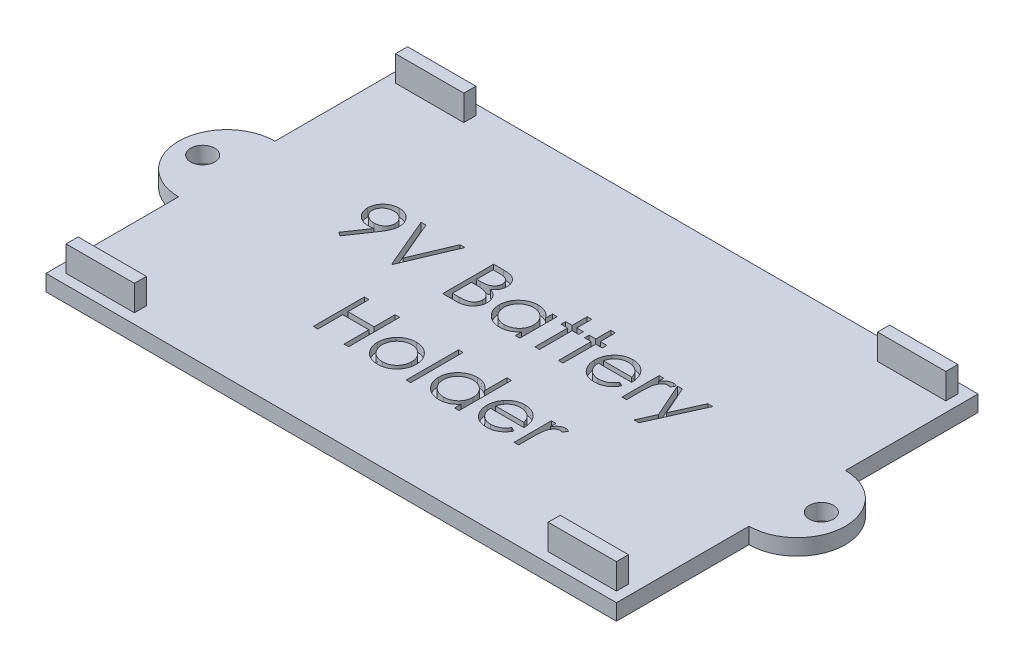
from build123d import *

# Parameters (mm, degrees)
SKETCH1_W               = 71
SKETCH1_H               = 45
BOSS_EXTRUDE1_DEPTH     = 2
SKETCH2_W               = 8.5
SKETCH2_H               = 1.5
BOSS_EXTRUDE2_DEPTH     = 3.175
MIRROR2_COPY_1_SKETCH_W = 8.5
MIRROR2_COPY_1_SKETCH_H = 1.5
MIRROR2_COPY_1_DEPTH    = 3.175
SKETCH3_W               = 0.569871795
SKETCH3_H               = 6.512820512
CUT_EXTRUDE1_DEPTH      = 1
BOSS_EXTRUDE3_DEPTH     = 2
SKETCH5_R               = 1.5
CUT_EXTRUDE2_DEPTH      = 2


with BuildPart() as part:
    # Sketch1 → Boss-Extrude1 (new body)
    with BuildSketch(Plane(origin=(0, 0, 0), x_dir=(1, 0, 0), z_dir=(0, 1, 0))):
        Rectangle(SKETCH1_W, SKETCH1_H)
    extrude(amount=BOSS_EXTRUDE1_DEPTH)

    # Sketch2 → Boss-Extrude2 (add)
    with BuildSketch(Plane(origin=(0, 2, 0), x_dir=(1, 0, 0), z_dir=(0, 1, 0))):
        with Locations((-30, -20.5)):
            Rectangle(SKETCH2_W, SKETCH2_H)
    boss_extrude2 = extrude(amount=BOSS_EXTRUDE2_DEPTH)

    # Mirror1: Boss-Extrude2 across plane
    add(boss_extrude2.mirror(Plane.XY))

    # Mirror2: Boss-Extrude2 across plane
    add(boss_extrude2.mirror(Plane(origin=(0, 0, 0), x_dir=(0, 0, 1), z_dir=(1, 0, 0))))

    # Mirror2 copy 1 sketch → Mirror2 copy 1 (add)
    with BuildSketch(Plane(origin=(0, 2, 0), x_dir=(-1, 0, 0), z_dir=(0, 1, 0))):
        with Locations((-30, -20.5)):
            Rectangle(MIRROR2_COPY_1_SKETCH_W, MIRROR2_COPY_1_SKETCH_H)
    extrude(amount=MIRROR2_COPY_1_DEPTH)

    # Sketch3 → Cut-Extrude1 (cut)
    # profile 1 of 15: a face of its own
    with BuildSketch(Plane(origin=(0, 2, 0), x_dir=(1, 0, 0), z_dir=(0, 1, 0))):
        with BuildLine():
            Line((-21.248076923, -0.162820513), (-21.703465545, 0.153916266))
            Line((-21.703465545, 0.153916266), (-19.937880609, 2.734875801))
            add(Edge.make_bspline(
                [(-19.937880609, 2.734875801), (-20.050530944, 2.721099815), (-20.272345733, 2.69397413), (-20.495751618, 2.688990913), (-20.605699119, 2.686538462)],
                knots=[0, 0, 0, 0, 1.015715272, 2, 2, 2, 2], degree=3))
            add(Edge.make_bspline(
                [(-20.605699119, 2.686538462), (-20.672359691, 2.688245843), (-20.803208565, 2.691597284), (-20.995580278, 2.718161707), (-21.180429795, 2.759074082), (-21.357267055, 2.820122538), (-21.526756728, 2.895992717), (-21.688528808, 2.990076156), (-21.842365524, 3.100758999), (-21.986614682, 3.227455998), (-22.117808837, 3.366571893), (-22.234691105, 3.513811417), (-22.331830016, 3.670884964), (-22.41252325, 3.834588362), (-22.47371993, 4.007274527), (-22.518283391, 4.186978439), (-22.545719662, 4.374959561), (-22.548983736, 4.502912298), (-22.550641026, 4.567878606)],
                knots=[0, 0, 0, 0, 1.060718605, 2.082097864, 3.085795603, 4.069760067, 5.054557537, 6.03741023, 7.043284206, 8.066802108, 9.088538119, 10.083643548, 11.053783639, 12.022749082, 12.983451788, 13.964007469, 14.966251758, 16, 16, 16, 16], degree=3))
            add(Edge.make_bspline(
                [(-22.550641026, 4.567878606), (-22.547494265, 4.656721733), (-22.541317813, 4.831102769), (-22.491609075, 5.08588975), (-22.409856745, 5.326802479), (-22.295868119, 5.553207545), (-22.152295124, 5.761848115), (-21.979740968, 5.949823734), (-21.779255204, 6.114460826), (-21.555404969, 6.255982509), (-21.313464489, 6.369801719), (-21.060065638, 6.453693021), (-20.79715002, 6.503039321), (-20.619045818, 6.509545097), (-20.529377003, 6.512820513)],
                knots=[0, 0, 0, 0, 1.022988612, 2.007919123, 2.978103895, 3.94594894, 4.918897164, 5.887013414, 6.875921846, 7.89917871, 8.930658928, 9.948724884, 10.967259574, 12, 12, 12, 12], degree=3))
            add(Edge.make_bspline(
                [(-20.529377003, 6.512820513), (-20.441405156, 6.509500074), (-20.267581078, 6.5029392), (-20.011968167, 6.454889713), (-19.767146607, 6.373906036), (-19.53447356, 6.261992613), (-19.319046341, 6.121710395), (-19.125324512, 5.954552044), (-18.957728891, 5.760413445), (-18.816534136, 5.543990042), (-18.703195634, 5.311458519), (-18.621421635, 5.068736259), (-18.571083118, 4.817568865), (-18.564739782, 4.64739889), (-18.561538462, 4.561518429)],
                knots=[0, 0, 0, 0, 1.026385292, 2.028040595, 3.023318987, 4.028184125, 5.03290303, 6.015178782, 7.004435299, 8.016004309, 9.023023918, 10.015172535, 10.998308025, 12, 12, 12, 12], degree=3))
            add(Edge.make_bspline(
                [(-18.561538462, 4.561518429), (-18.563676432, 4.494854738), (-18.56801277, 4.359644114), (-18.598377213, 4.15421192), (-18.649939549, 3.944750404), (-18.708453345, 3.767455509), (-18.764935993, 3.621027322), (-18.818096617, 3.505363741), (-18.877082953, 3.383622877), (-18.945878427, 3.257081278), (-19.01983288, 3.124125822), (-19.103397567, 2.986090038), (-19.194666248, 2.842788693), (-19.259671596, 2.746183262), (-19.292958734, 2.696714744)],
                knots=[0, 0, 0, 0, 1.179839688, 2.393009684, 3.667231171, 4.993948276, 5.694988576, 6.444077775, 7.246288328, 8.089075292, 8.993003841, 9.939041771, 10.944649915, 12, 12, 12, 12], degree=3))
            Line((-19.292958734, 2.696714744), (-21.248076923, -0.162820513))
        make_face()
        with BuildLine():
            add(Edge.make_bspline(
                [(-20.500120192, 3.337820513), (-20.449621338, 3.339200066), (-20.351317237, 3.341885588), (-20.207304137, 3.358230927), (-20.071370225, 3.387212301), (-19.943152387, 3.428795208), (-19.821365008, 3.478972307), (-19.707942527, 3.54285691), (-19.602790019, 3.619087091), (-19.505203351, 3.704739548), (-19.418545809, 3.799899892), (-19.341360596, 3.899498928), (-19.275754995, 4.003973864), (-19.223933049, 4.114633068), (-19.18132532, 4.228782861), (-19.151901212, 4.348261477), (-19.135601065, 4.472446432), (-19.13282235, 4.556808283), (-19.131410256, 4.599679487)],
                knots=[0, 0, 0, 0, 1.163407946, 2.26475976, 3.333800367, 4.359385343, 5.366239384, 6.363380779, 7.350133999, 8.353570782, 9.349036268, 10.310270964, 11.253520213, 12.184142, 13.120487599, 14.056272588, 15.012232024, 16, 16, 16, 16], degree=3))
            add(Edge.make_bspline(
                [(-19.131410256, 4.599679487), (-19.132625228, 4.642568594), (-19.135019477, 4.72708684), (-19.154227864, 4.851455654), (-19.18801934, 4.970641998), (-19.23335922, 5.085298378), (-19.293085937, 5.194482767), (-19.364756547, 5.299565963), (-19.44990542, 5.399881681), (-19.547881504, 5.493070623), (-19.653535622, 5.57897324), (-19.766131101, 5.65478512), (-19.884739877, 5.718323577), (-20.008638337, 5.770754565), (-20.138084627, 5.811669929), (-20.273002149, 5.841092862), (-20.41407267, 5.857370189), (-20.509833004, 5.86013134), (-20.558633814, 5.861538462)],
                knots=[0, 0, 0, 0, 0.972161553, 1.915763587, 2.844109794, 3.775983486, 4.705125789, 5.659731448, 6.655561913, 7.682237399, 8.721216875, 9.739758359, 10.754845918, 11.767244016, 12.7857855, 13.828538656, 14.893392813, 16, 16, 16, 16], degree=3))
            add(Edge.make_bspline(
                [(-20.558633814, 5.861538462), (-20.607010207, 5.860129067), (-20.70192429, 5.857363846), (-20.841740694, 5.841123803), (-20.975745956, 5.811472053), (-21.104817181, 5.770773517), (-21.22871196, 5.718319666), (-21.347315142, 5.654781791), (-21.459936958, 5.578990691), (-21.56548978, 5.493003032), (-21.663638867, 5.400315446), (-21.747323755, 5.29912651), (-21.819158388, 5.19453743), (-21.878803036, 5.085283851), (-21.924164746, 4.970645876), (-21.957950377, 4.851454604), (-21.977160334, 4.727087114), (-21.979554369, 4.642568686), (-21.980769231, 4.599679487)],
                knots=[0, 0, 0, 0, 1.099389452, 2.15699305, 3.192601482, 4.213358962, 5.227959689, 6.245255729, 7.266013209, 8.307253147, 9.336162325, 10.327954924, 11.284637477, 12.215801273, 13.149702402, 14.080068371, 15.025723358, 16, 16, 16, 16], degree=3))
            add(Edge.make_bspline(
                [(-21.980769231, 4.599679487), (-21.979669908, 4.556774898), (-21.977501841, 4.472159196), (-21.956587137, 4.34783274), (-21.921610829, 4.228655588), (-21.874767078, 4.113468934), (-21.813078479, 4.003392848), (-21.737379497, 3.898949206), (-21.648650864, 3.798954032), (-21.548078679, 3.704960948), (-21.438009301, 3.618687715), (-21.320449491, 3.543339736), (-21.197423072, 3.479708301), (-21.068496971, 3.42865179), (-20.934626634, 3.387627772), (-20.794608895, 3.35828434), (-20.648906807, 3.342042371), (-20.550191555, 3.3392413), (-20.500120192, 3.337820513)],
                knots=[0, 0, 0, 0, 0.952633368, 1.87876736, 2.791047057, 3.707742249, 4.635551637, 5.587206343, 6.568248508, 7.601284464, 8.641511608, 9.671105535, 10.699146789, 11.713763218, 12.747829548, 13.806491675, 14.887386225, 16, 16, 16, 16], degree=3))
        make_face(mode=Mode.SUBTRACT)
    # profile 2 of 15: a face of its own
    with BuildSketch(Plane(origin=(0, 2, 0), x_dir=(1, 0, 0), z_dir=(0, 1, 0))):
        Polygon((-17.666025641, 6.35), (-17.055448718, 6.35), (-14.938782051, 1.345813301), (-12.822115385, 6.35), (-12.211538462, 6.35), (-14.898076923, 0), (-14.979487179, 0), align=None)
    # profile 3 of 15: a face of its own
    with BuildSketch(Plane(origin=(0, 2, 0), x_dir=(1, 0, 0), z_dir=(0, 1, 0))):
        with BuildLine():
            Line((-8.629487179, 6.35), (-7.39052484, 6.35))
            add(Edge.make_bspline(
                [(-7.39052484, 6.35), (-7.329876029, 6.349681139), (-7.212323541, 6.349063106), (-7.041382553, 6.339477996), (-6.881273997, 6.326408481), (-6.731951438, 6.305671027), (-6.593483878, 6.280648803), (-6.465454022, 6.250346937), (-6.348268995, 6.214012938), (-6.208364459, 6.156234684), (-6.04885126, 6.070376936), (-5.876134176, 5.943506539), (-5.728443628, 5.788326213), (-5.601105595, 5.61327911), (-5.499866421, 5.420718496), (-5.426624982, 5.215233967), (-5.380255693, 4.99947595), (-5.375486963, 4.851351899), (-5.373076923, 4.776492388)],
                knots=[0, 0, 0, 0, 1.001505555, 1.941167018, 2.826882275, 3.653841531, 4.429895133, 5.150066043, 5.825578002, 6.45369114, 7.647487171, 8.808567382, 9.977351308, 11.170798116, 12.373658725, 13.556498008, 14.765093433, 16, 16, 16, 16], degree=3))
            add(Edge.make_bspline(
                [(-5.373076923, 4.776492388), (-5.375060334, 4.706365608), (-5.378957923, 4.568559873), (-5.416228357, 4.367003418), (-5.474576999, 4.175140492), (-5.555685094, 3.993671307), (-5.661098715, 3.826696038), (-5.786027379, 3.672867712), (-5.936752435, 3.538699366), (-6.049679456, 3.463691528), (-6.107041266, 3.425590946)],
                knots=[0, 0, 0, 0, 1.044552857, 2.05264487, 3.044412934, 4.028983338, 5.005914585, 5.980388656, 6.974128949, 8, 8, 8, 8], degree=3))
            add(Edge.make_bspline(
                [(-6.107041266, 3.425590946), (-6.03490449, 3.397895876), (-5.896888969, 3.344908347), (-5.706958632, 3.251226863), (-5.543319413, 3.149332748), (-5.404713162, 3.038059249), (-5.286171988, 2.918118978), (-5.182661652, 2.78775327), (-5.09433973, 2.645261524), (-5.018660569, 2.492129396), (-4.959607826, 2.329920517), (-4.91538297, 2.160156395), (-4.890042027, 1.983445773), (-4.886435878, 1.863185156), (-4.884615385, 1.802473958)],
                knots=[0, 0, 0, 0, 1.27268992, 2.434971085, 3.483601985, 4.442670788, 5.356604649, 6.2567628, 7.179492994, 8.113709626, 9.066344395, 10.018646069, 10.999752585, 12, 12, 12, 12], degree=3))
            add(Edge.make_bspline(
                [(-4.884615385, 1.802473958), (-4.886387662, 1.74048549), (-4.889874669, 1.618521443), (-4.915601189, 1.439351413), (-4.959160569, 1.268128296), (-5.019161077, 1.103744607), (-5.097469848, 0.946518363), (-5.192770583, 0.796271441), (-5.306402134, 0.654513441), (-5.433516197, 0.519669154), (-5.577320375, 0.398424454), (-5.732470387, 0.290445958), (-5.900920139, 0.201643816), (-6.079903043, 0.127047606), (-6.271426873, 0.070065974), (-6.474631604, 0.030201447), (-6.68934198, 0.00334088), (-6.836679671, 0.001132523), (-6.912239583, 0)],
                knots=[0, 0, 0, 0, 0.978564426, 1.925352924, 2.850884081, 3.763762016, 4.682927383, 5.618979971, 6.567305752, 7.547517671, 8.540179244, 9.531824382, 10.526200242, 11.540722885, 12.589160233, 13.674978461, 14.80764778, 16, 16, 16, 16], degree=3))
            Line((-6.912239583, 0), (-8.629487179, 0))
            Line((-8.629487179, 0), (-8.629487179, 6.35))
        make_face()
        with BuildLine():
            Line((-8.059615385, 5.698717949), (-8.059615385, 3.663461538))
            Line((-8.059615385, 3.663461538), (-7.676732772, 3.663461538))
            add(Edge.make_bspline(
                [(-7.676732772, 3.663461538), (-7.620764244, 3.664187113), (-7.51262164, 3.665589071), (-7.356012685, 3.669605023), (-7.210643009, 3.680850045), (-7.076763541, 3.692091835), (-6.954585107, 3.710370015), (-6.844378387, 3.732127153), (-6.744413789, 3.755137566), (-6.6291349, 3.794270778), (-6.498373979, 3.852105989), (-6.358976776, 3.941862034), (-6.236087095, 4.048767646), (-6.132315054, 4.172122677), (-6.047385672, 4.307951329), (-5.988396503, 4.454086383), (-5.948396431, 4.606885765), (-5.944783224, 4.711784596), (-5.942948718, 4.765044071)],
                knots=[0, 0, 0, 0, 1.156816544, 2.235205308, 3.236616184, 4.169592532, 5.011045266, 5.787822928, 6.49130361, 7.128639758, 8.301311294, 9.436451833, 10.541879658, 11.654887649, 12.756523258, 13.837046038, 14.901820046, 16, 16, 16, 16], degree=3))
            add(Edge.make_bspline(
                [(-5.942948718, 4.765044071), (-5.943903359, 4.80028797), (-5.945775992, 4.869422728), (-5.961112698, 4.970205128), (-5.987179583, 5.064990222), (-6.020660944, 5.155076965), (-6.067448993, 5.237648464), (-6.122536991, 5.315559691), (-6.189095315, 5.386157392), (-6.264855011, 5.452142053), (-6.351956369, 5.510642839), (-6.450347427, 5.561879652), (-6.561359356, 5.603137918), (-6.68312125, 5.639271509), (-6.817507366, 5.664650271), (-6.962966913, 5.685792846), (-7.120691331, 5.696556535), (-7.229811732, 5.697981407), (-7.286217949, 5.698717949)],
                knots=[0, 0, 0, 0, 0.91205012, 1.789085906, 2.630437955, 3.453916878, 4.269457761, 5.079663411, 5.91843418, 6.774407191, 7.675494373, 8.627863946, 9.638891023, 10.736472738, 11.911756761, 13.175263542, 14.539845004, 16, 16, 16, 16], degree=3))
            Line((-7.286217949, 5.698717949), (-8.059615385, 5.698717949))
        make_face(mode=Mode.SUBTRACT)
        with BuildLine():
            Line((-8.059615385, 3.012179487), (-8.059615385, 0.651282051))
            Line((-8.059615385, 0.651282051), (-7.248056891, 0.651282051))
            add(Edge.make_bspline(
                [(-7.248056891, 0.651282051), (-7.189965411, 0.651978279), (-7.078001742, 0.653320165), (-6.916346653, 0.657700857), (-6.766517308, 0.667665414), (-6.629197404, 0.683351456), (-6.502904154, 0.700366642), (-6.389152608, 0.723247109), (-6.287020671, 0.749461652), (-6.168594427, 0.789982221), (-6.035238062, 0.852931533), (-5.891526937, 0.947844487), (-5.763753655, 1.060916774), (-5.655249828, 1.191782861), (-5.566326263, 1.334079697), (-5.50163708, 1.484929117), (-5.461739383, 1.641838574), (-5.456909447, 1.748821038), (-5.454487179, 1.802473958)],
                knots=[0, 0, 0, 0, 1.160039823, 2.235823828, 3.228722157, 4.157150951, 4.99529583, 5.772374946, 6.472645482, 7.099169577, 8.269452708, 9.405989375, 10.527446681, 11.663510218, 12.788923519, 13.866172445, 14.929861265, 16, 16, 16, 16], degree=3))
            add(Edge.make_bspline(
                [(-5.454487179, 1.802473958), (-5.454988112, 1.836026162), (-5.455981896, 1.902589369), (-5.470969012, 2.000408069), (-5.492765604, 2.095160725), (-5.520944062, 2.187104626), (-5.561982238, 2.274577466), (-5.609891256, 2.359309252), (-5.666064085, 2.441411994), (-5.753592786, 2.545211368), (-5.880904815, 2.664803663), (-6.061801393, 2.781893131), (-6.267491133, 2.876322724), (-6.416675299, 2.916417488), (-6.493739984, 2.937129407)],
                knots=[0, 0, 0, 0, 0.723448775, 1.435228256, 2.130040452, 2.821711965, 3.505591119, 4.210454504, 4.921174351, 5.648778258, 7.137944449, 8.670945889, 10.280296675, 12, 12, 12, 12], degree=3))
            add(Edge.make_bspline(
                [(-6.493739984, 2.937129407), (-6.524635629, 2.943397917), (-6.591623761, 2.956989338), (-6.700857514, 2.971336171), (-6.825564019, 2.984117923), (-6.966031239, 2.993572452), (-7.122436894, 3.003345181), (-7.295115018, 3.007145785), (-7.483360432, 3.011680157), (-7.613975164, 3.012008786), (-7.681820913, 3.012179487)],
                knots=[0, 0, 0, 0, 0.634451884, 1.375622551, 2.216452059, 3.157844607, 4.20941857, 5.370758133, 6.634282058, 8, 8, 8, 8], degree=3))
            Line((-7.681820913, 3.012179487), (-8.059615385, 3.012179487))
        make_face(mode=Mode.SUBTRACT)
    # profile 4 of 15: a face of its own
    with BuildSketch(Plane(origin=(0, 2, 0), x_dir=(1, 0, 0), z_dir=(0, 1, 0))):
        with BuildLine():
            Line((0.976923077, 4.640384615), (0.976923077, 0))
            Line((0.976923077, 0), (0.407051282, 0))
            Line((0.407051282, 0), (0.407051282, 0.802654247))
            add(Edge.make_bspline(
                [(0.407051282, 0.802654247), (0.342791476, 0.730010983), (0.217387657, 0.588246742), (0.007944486, 0.403040514), (-0.214066351, 0.249954131), (-0.44756732, 0.126310713), (-0.692347561, 0.033433696), (-0.947864462, -0.032581193), (-1.214222253, -0.075024294), (-1.396108668, -0.079262505), (-1.48828125, -0.081410256)],
                knots=[0, 0, 0, 0, 1.074387032, 2.096679803, 3.090159297, 4.057316773, 5.018401886, 5.985159533, 6.978961417, 8, 8, 8, 8], degree=3))
            add(Edge.make_bspline(
                [(-1.48828125, -0.081410256), (-1.570228823, -0.079185267), (-1.731833067, -0.074797489), (-1.969557249, -0.040757309), (-2.198324616, 0.013908247), (-2.418351341, 0.089928433), (-2.628213662, 0.190767923), (-2.829708409, 0.311492759), (-3.021791721, 0.455258265), (-3.201535799, 0.619610831), (-3.367056714, 0.79812745), (-3.512310737, 0.988528657), (-3.633419897, 1.189991122), (-3.734693472, 1.39996413), (-3.812701125, 1.620064056), (-3.867081861, 1.849529775), (-3.901082386, 2.088089974), (-3.905468351, 2.250540251), (-3.907692308, 2.33291266)],
                knots=[0, 0, 0, 0, 1.033919861, 2.038935746, 3.024066025, 3.998881131, 4.97069526, 5.957263378, 6.95902576, 7.993208707, 9.027059324, 10.027763471, 11.009749337, 11.988697705, 12.965288445, 13.950418724, 14.960734635, 16, 16, 16, 16], degree=3))
            add(Edge.make_bspline(
                [(-3.907692308, 2.33291266), (-3.90541906, 2.413582522), (-3.900924971, 2.573062488), (-3.867445558, 2.807610983), (-3.811146442, 3.033522685), (-3.732138204, 3.250070282), (-3.630824943, 3.457515801), (-3.507583985, 3.656005961), (-3.36240643, 3.846087582), (-3.195034206, 4.023291094), (-3.01372398, 4.186977065), (-2.819760997, 4.329233476), (-2.617970187, 4.452091188), (-2.405221582, 4.549433923), (-2.18466412, 4.628190441), (-1.954334297, 4.682678826), (-1.715190433, 4.714786824), (-1.552829112, 4.71943641), (-1.470472756, 4.721794872)],
                knots=[0, 0, 0, 0, 1.020392517, 2.01726096, 2.990465484, 3.961182959, 4.928053699, 5.906110375, 6.912531644, 7.948652711, 8.985773172, 9.998621852, 10.987621588, 11.969261332, 12.953316658, 13.946091881, 14.958173133, 16, 16, 16, 16], degree=3))
            add(Edge.make_bspline(
                [(-1.470472756, 4.721794872), (-1.375767298, 4.71918638), (-1.190054363, 4.71407125), (-0.918404975, 4.671503159), (-0.661421422, 4.599587654), (-0.417119955, 4.501765908), (-0.186377853, 4.371774642), (0.028620418, 4.20779957), (0.230124938, 4.010874845), (0.346929182, 3.859617039), (0.407051282, 3.781760817)],
                knots=[0, 0, 0, 0, 1.038897134, 2.037228247, 3.008116434, 3.962042015, 4.918381754, 5.904844433, 6.921570401, 8, 8, 8, 8], degree=3))
            Line((0.407051282, 3.781760817), (0.407051282, 4.640384615))
            Line((0.407051282, 4.640384615), (0.976923077, 4.640384615))
        make_face()
        with BuildLine():
            add(Edge.make_bspline(
                [(-1.462840545, 4.151923077), (-1.546142272, 4.148959191), (-1.710566632, 4.143108953), (-1.951946464, 4.09743704), (-2.182929373, 4.021446419), (-2.402360108, 3.917520684), (-2.606772443, 3.786839976), (-2.789459532, 3.628776895), (-2.951915576, 3.447644026), (-3.088546284, 3.244258769), (-3.199926185, 3.026221375), (-3.278243515, 2.798302752), (-3.329894864, 2.564613721), (-3.335171751, 2.406112848), (-3.337820513, 2.326552484)],
                knots=[0, 0, 0, 0, 1.031046209, 2.035121221, 3.029706178, 4.034933723, 5.034054252, 6.02443088, 7.017295772, 8.038157696, 9.050218397, 10.03989886, 11.016116709, 12, 12, 12, 12], degree=3))
            add(Edge.make_bspline(
                [(-3.337820513, 2.326552484), (-3.334437064, 2.247467575), (-3.327683427, 2.089607744), (-3.279150024, 1.855600126), (-3.197725111, 1.627627793), (-3.086614511, 1.407625704), (-2.947483064, 1.203365979), (-2.786213651, 1.018780328), (-2.601246712, 0.860049218), (-2.396363949, 0.727175335), (-2.177546632, 0.619837618), (-1.947433642, 0.545151387), (-1.710350698, 0.496931699), (-1.549147178, 0.491299291), (-1.467928686, 0.488461538)],
                knots=[0, 0, 0, 0, 0.979072187, 1.954306742, 2.945804271, 3.96968567, 4.997920485, 5.998718438, 6.996577872, 8.005894225, 9.015743152, 10.005417472, 10.995077863, 12, 12, 12, 12], degree=3))
            add(Edge.make_bspline(
                [(-1.467928686, 0.488461538), (-1.385475745, 0.491473187), (-1.221485024, 0.497463058), (-0.979389082, 0.543330497), (-0.744448221, 0.619111031), (-0.519862821, 0.724156589), (-0.310646412, 0.854344935), (-0.122871691, 1.0067578), (0.03590728, 1.184019291), (0.170513872, 1.378830856), (0.276060699, 1.59239405), (0.352942978, 1.819786081), (0.398397921, 2.061014867), (0.404126945, 2.225867992), (0.407051282, 2.310016026)],
                knots=[0, 0, 0, 0, 1.01762866, 2.023962475, 3.030623092, 4.058876274, 5.077231937, 6.066672613, 7.034107872, 8.005628644, 8.981990164, 9.965428785, 10.961468474, 12, 12, 12, 12], degree=3))
            add(Edge.make_bspline(
                [(0.407051282, 2.310016026), (0.405310191, 2.374128947), (0.401883173, 2.500323464), (0.375701997, 2.685611961), (0.334055202, 2.862928863), (0.275370008, 3.032460599), (0.198278678, 3.193269842), (0.105300588, 3.346511235), (-0.005199299, 3.491387776), (-0.131442191, 3.62590449), (-0.26962763, 3.748598215), (-0.415849153, 3.858116194), (-0.571839166, 3.948084396), (-0.734974361, 4.022544989), (-0.905537782, 4.081798018), (-1.084917335, 4.121327119), (-1.271206354, 4.148469416), (-1.398289912, 4.150759736), (-1.462840545, 4.151923077)],
                knots=[0, 0, 0, 0, 1.050140795, 2.067009409, 3.05949893, 4.030605086, 5.00011959, 5.97591094, 6.962425594, 7.979863591, 8.993523472, 9.986985069, 10.967611495, 11.937549037, 12.921786183, 13.919465291, 14.943216303, 16, 16, 16, 16], degree=3))
        make_face(mode=Mode.SUBTRACT)
    # profile 5 of 15: a face of its own
    with BuildSketch(Plane(origin=(0, 2, 0), x_dir=(1, 0, 0), z_dir=(0, 1, 0))):
        Polygon((2.849358974, 6.512820513), (3.419230769, 6.512820513), (3.419230769, 4.640384615), (4.233333333, 4.640384615), (4.233333333, 4.070512821), (3.419230769, 4.070512821), (3.419230769, 0), (2.849358974, 0), (2.849358974, 4.070512821), (2.03525641, 4.070512821), (2.03525641, 4.640384615), (2.849358974, 4.640384615), align=None)
    # profile 6 of 15: a face of its own
    with BuildSketch(Plane(origin=(0, 2, 0), x_dir=(1, 0, 0), z_dir=(0, 1, 0))):
        Polygon((5.780128205, 6.512820513), (6.35, 6.512820513), (6.35, 4.640384615), (7.164102564, 4.640384615), (7.164102564, 4.070512821), (6.35, 4.070512821), (6.35, 0), (5.780128205, 0), (5.780128205, 4.070512821), (4.966025641, 4.070512821), (4.966025641, 4.640384615), (5.780128205, 4.640384615), align=None)
    # profile 7 of 15: a face of its own
    with BuildSketch(Plane(origin=(0, 2, 0), x_dir=(1, 0, 0), z_dir=(0, 1, 0))):
        with BuildLine():
            Line((11.949499199, 1.465384615), (12.455769231, 1.199529247))
            add(Edge.make_bspline(
                [(12.455769231, 1.199529247), (12.415425694, 1.127967774), (12.336933147, 0.988737488), (12.201948933, 0.79745397), (12.06044903, 0.625373114), (11.906046116, 0.477092169), (11.743359699, 0.3478218), (11.571487597, 0.234723175), (11.389535027, 0.138351002), (11.197493384, 0.05715713), (10.993749912, -0.005271524), (10.777810875, -0.049366324), (10.549262591, -0.076622826), (10.39260595, -0.07978901), (10.312389824, -0.081410256)],
                knots=[0, 0, 0, 0, 1.120438281, 2.179929193, 3.190490725, 4.156257408, 5.095198341, 6.022838206, 6.959905092, 7.901321166, 8.864066838, 9.862729781, 10.905609505, 12, 12, 12, 12], degree=3))
            add(Edge.make_bspline(
                [(10.312389824, -0.081410256), (10.223232236, -0.079328953), (10.049311611, -0.075268932), (9.796146641, -0.040266889), (9.557786839, 0.016832962), (9.334245606, 0.096599015), (9.126070377, 0.200788589), (8.932847397, 0.327715078), (8.753560543, 0.476726454), (8.593859478, 0.64911343), (8.450088433, 0.833593552), (8.323223017, 1.0258278), (8.217164535, 1.225332507), (8.130890514, 1.430837601), (8.061213116, 1.641047808), (8.012650668, 1.857875756), (7.984656696, 2.080734602), (7.980366917, 2.231496911), (7.978205128, 2.307471955)],
                knots=[0, 0, 0, 0, 1.145258523, 2.234067595, 3.276747158, 4.290159414, 5.277019952, 6.260822364, 7.254936242, 8.264827045, 9.274100331, 10.257902744, 11.220704747, 12.172965371, 13.118907548, 14.062713208, 15.023725156, 16, 16, 16, 16], degree=3))
            add(Edge.make_bspline(
                [(7.978205128, 2.307471955), (7.980126713, 2.378764005), (7.983935041, 2.520055432), (8.007939469, 2.729180063), (8.050481373, 2.932431684), (8.108858417, 3.129979182), (8.18424425, 3.321491797), (8.276468419, 3.507086084), (8.38567459, 3.686564552), (8.469989298, 3.799781666), (8.512459936, 3.856810897)],
                knots=[0, 0, 0, 0, 1.024358464, 2.0301432, 3.019427413, 4.004406732, 4.986367066, 5.972626655, 6.978780325, 8, 8, 8, 8], degree=3))
            add(Edge.make_bspline(
                [(8.512459936, 3.856810897), (8.569986732, 3.925515847), (8.683218021, 4.060749349), (8.874727408, 4.238437454), (9.082100622, 4.387288304), (9.302738857, 4.510672679), (9.53920646, 4.604423439), (9.788324746, 4.674287195), (10.052930309, 4.713435872), (10.233824067, 4.718965513), (10.326382212, 4.721794872)],
                knots=[0, 0, 0, 0, 1.030682036, 2.02871468, 2.997146059, 3.962720338, 4.930598197, 5.918074684, 6.934738563, 8, 8, 8, 8], degree=3))
            add(Edge.make_bspline(
                [(10.326382212, 4.721794872), (10.421537153, 4.71933824), (10.608209456, 4.714518889), (10.88041059, 4.669839684), (11.13796789, 4.598987192), (11.380778291, 4.498922458), (11.608866409, 4.3698187), (11.820749671, 4.209904216), (12.020051701, 4.024088544), (12.136000122, 3.881189578), (12.195002003, 3.808473558)],
                knots=[0, 0, 0, 0, 1.056321875, 2.072262726, 3.055038591, 4.01806755, 4.982017516, 5.957941055, 6.960871419, 8, 8, 8, 8], degree=3))
            add(Edge.make_bspline(
                [(12.195002003, 3.808473558), (12.235146591, 3.753675631), (12.315168553, 3.64444453), (12.415402577, 3.466334003), (12.502410994, 3.279987638), (12.571957938, 3.082393242), (12.628272461, 2.875892004), (12.669015547, 2.659007673), (12.692908997, 2.431804834), (12.697605634, 2.276998083), (12.7, 2.198076923)],
                knots=[0, 0, 0, 0, 0.94817472, 1.890038105, 2.849395472, 3.817997239, 4.812318967, 5.836947057, 6.897266129, 8, 8, 8, 8], degree=3))
            Line((12.7, 2.198076923), (8.548076923, 2.198076923))
            add(Edge.make_bspline(
                [(8.548076923, 2.198076923), (8.550870209, 2.136934652), (8.556363093, 2.016700843), (8.581971996, 1.840768136), (8.622337628, 1.673176501), (8.679068642, 1.515182982), (8.747769918, 1.364724036), (8.831926862, 1.222915769), (8.932328624, 1.090404096), (9.044316678, 0.966003718), (9.16897098, 0.855222051), (9.300112536, 0.756068114), (9.439619432, 0.672963675), (9.586391669, 0.605508732), (9.740191908, 0.552701558), (9.901068605, 0.516655655), (10.068705187, 0.492512761), (10.182979305, 0.489828226), (10.241155849, 0.488461538)],
                knots=[0, 0, 0, 0, 1.094153842, 2.151609401, 3.174256925, 4.172055639, 5.149267565, 6.128595816, 7.11444997, 8.118368179, 9.117203808, 10.09244225, 11.054858984, 12.015122123, 12.976791628, 13.957293641, 14.960065497, 16, 16, 16, 16], degree=3))
            add(Edge.make_bspline(
                [(10.241155849, 0.488461538), (10.298035789, 0.489564727), (10.410896499, 0.491753665), (10.578973483, 0.513038703), (10.744326626, 0.547456203), (10.906271553, 0.594428042), (11.061521516, 0.651717474), (11.205295585, 0.720846944), (11.337521119, 0.797318628), (11.461104759, 0.884784752), (11.580976418, 0.991842463), (11.699889215, 1.1254387), (11.827391143, 1.283440357), (11.907200833, 1.402358923), (11.949499199, 1.465384615)],
                knots=[0, 0, 0, 0, 0.99110716, 1.966546729, 2.947904876, 3.932708344, 4.903319531, 5.828989031, 6.710028674, 7.56322171, 8.463672341, 9.504779593, 10.677557249, 12, 12, 12, 12], degree=3))
        make_face()
        with BuildLine():
            add(Edge.make_bspline(
                [(12.130128205, 2.767948718), (12.109270043, 2.843537075), (12.069124796, 2.989020329), (11.985238821, 3.19048023), (11.890766169, 3.369528279), (11.778966742, 3.524794185), (11.652295625, 3.662686273), (11.505982222, 3.783188563), (11.341905673, 3.890988796), (11.160914089, 3.981979759), (10.969249707, 4.05943136), (10.768578473, 4.111365498), (10.563822201, 4.146942811), (10.425329996, 4.150255893), (10.355639022, 4.151923077)],
                knots=[0, 0, 0, 0, 1.154881502, 2.222775134, 3.210006277, 4.132804581, 5.035138423, 5.962687519, 6.919655026, 7.923214229, 8.944639381, 9.960483929, 10.97369054, 12, 12, 12, 12], degree=3))
            add(Edge.make_bspline(
                [(10.355639022, 4.151923077), (10.298762184, 4.15081333), (10.186328632, 4.148619594), (10.020682408, 4.127809502), (9.861606383, 4.093410926), (9.70792679, 4.046303076), (9.5616575, 3.983513183), (9.419789849, 3.909883615), (9.28593113, 3.820001027), (9.202217637, 3.751495676), (9.159925881, 3.716887019)],
                knots=[0, 0, 0, 0, 1.04873581, 2.073130211, 3.073294108, 4.04793562, 5.032784715, 6.005352987, 6.992311501, 8, 8, 8, 8], degree=3))
            add(Edge.make_bspline(
                [(9.159925881, 3.716887019), (9.129639498, 3.689501618), (9.068347241, 3.63408024), (8.986449437, 3.538595823), (8.908035151, 3.435632274), (8.836672667, 3.321250405), (8.771217617, 3.196752706), (8.709967373, 3.063189282), (8.65483774, 2.919546603), (8.623820511, 2.819448035), (8.60786258, 2.767948718)],
                knots=[0, 0, 0, 0, 0.879870761, 1.780643979, 2.707998968, 3.669668524, 4.684282772, 5.740141944, 6.837334558, 8, 8, 8, 8], degree=3))
            Line((8.60786258, 2.767948718), (12.130128205, 2.767948718))
        make_face(mode=Mode.SUBTRACT)
    # profile 8 of 15: a face of its own
    with BuildSketch(Plane(origin=(0, 2, 0), x_dir=(1, 0, 0), z_dir=(0, 1, 0))):
        with BuildLine():
            Line((13.676923077, 4.640384615), (14.246794872, 4.640384615))
            Line((14.246794872, 4.640384615), (14.246794872, 3.957301683))
            add(Edge.make_bspline(
                [(14.246794872, 3.957301683), (14.288865906, 4.020902971), (14.369326431, 4.142539941), (14.503062745, 4.303411387), (14.640047361, 4.436607258), (14.780936058, 4.542749356), (14.926764896, 4.622238872), (15.074333366, 4.680464807), (15.225963147, 4.714895079), (15.327856923, 4.71949186), (15.37890625, 4.721794872)],
                knots=[0, 0, 0, 0, 1.2804753, 2.448899062, 3.506932113, 4.484331642, 5.4025378, 6.288909075, 7.142734305, 8, 8, 8, 8], degree=3))
            add(Edge.make_bspline(
                [(15.37890625, 4.721794872), (15.418505442, 4.719634916), (15.499983354, 4.715190668), (15.623323196, 4.683965315), (15.75040203, 4.634112331), (15.832303218, 4.587230784), (15.875, 4.562790465)],
                knots=[0, 0, 0, 0, 0.901110191, 1.854092781, 2.881294221, 4, 4, 4, 4], degree=3))
            Line((15.875, 4.562790465), (15.562079327, 4.069240785))
            add(Edge.make_bspline(
                [(15.562079327, 4.069240785), (15.534667246, 4.081469554), (15.482633868, 4.104682097), (15.406516298, 4.13215403), (15.336337301, 4.148330049), (15.291626845, 4.150780636), (15.270783253, 4.151923077)],
                knots=[0, 0, 0, 0, 1.180555205, 2.24091978, 3.179933427, 4, 4, 4, 4], degree=3))
            add(Edge.make_bspline(
                [(15.270783253, 4.151923077), (15.225052851, 4.148875009), (15.131776086, 4.142657834), (14.994825637, 4.09378314), (14.861934279, 4.014815919), (14.756394263, 3.92723833), (14.674674747, 3.842787326), (14.616363195, 3.76903951), (14.562873068, 3.68634685), (14.51176424, 3.596122995), (14.465198249, 3.496827417), (14.421737635, 3.389452159), (14.382442269, 3.273872854), (14.360035398, 3.193350281), (14.348557692, 3.152103365)],
                knots=[0, 0, 0, 0, 1.125678352, 2.296057538, 3.5422874, 4.923748041, 5.663163013, 6.437101912, 7.23742474, 8.08941207, 8.991984279, 9.93940061, 10.944477711, 12, 12, 12, 12], degree=3))
            add(Edge.make_bspline(
                [(14.348557692, 3.152103365), (14.339971779, 3.115314779), (14.320954632, 3.033830856), (14.302464271, 2.897127104), (14.284195288, 2.735612751), (14.271319995, 2.548838219), (14.259385547, 2.337269928), (14.252654398, 2.100585569), (14.247024414, 1.838542203), (14.246873707, 1.655345877), (14.246794872, 1.559515224)],
                knots=[0, 0, 0, 0, 0.566838948, 1.255505196, 2.06880316, 3.007127437, 4.065329342, 5.249902469, 6.561414163, 8, 8, 8, 8], degree=3))
            Line((14.246794872, 1.559515224), (14.246794872, 0))
            Line((14.246794872, 0), (13.676923077, 0))
            Line((13.676923077, 0), (13.676923077, 4.640384615))
        make_face()
    # profile 9 of 15: a face of its own
    with BuildSketch(Plane(origin=(0, 2, 0), x_dir=(1, 0, 0), z_dir=(0, 1, 0))):
        Polygon((15.956410256, 4.640384615), (16.570803285, 4.640384615), (18.141766827, 1.086318109), (19.736899038, 4.640384615), (20.352564103, 4.640384615), (17.503205128, -1.709615385), (16.887540064, -1.709615385), (17.83266226, 0.395602965), align=None)
    # profile 10 of 15: a face of its own
    with BuildSketch(Plane(origin=(0, 2, 0), x_dir=(1, 0, 0), z_dir=(0, 1, 0))):
        Polygon((-13.14775641, -5.233333333), (-12.577884615, -5.233333333), (-12.577884615, -7.838461538), (-9.321474359, -7.838461538), (-9.321474359, -5.233333333), (-8.751602564, -5.233333333), (-8.751602564, -11.583333333), (-9.321474359, -11.583333333), (-9.321474359, -8.48974359), (-12.577884615, -8.48974359), (-12.577884615, -11.583333333), (-13.14775641, -11.583333333), align=None)
    # profile 11 of 15: a face of its own
    with BuildSketch(Plane(origin=(0, 2, 0), x_dir=(1, 0, 0), z_dir=(0, 1, 0))):
        with BuildLine():
            add(Edge.make_bspline(
                [(-5.044891827, -6.861538462), (-4.957821946, -6.863392464), (-4.787099189, -6.86702771), (-4.53707631, -6.905880576), (-4.298415849, -6.965293651), (-4.070203758, -7.0474292), (-3.855362765, -7.157523596), (-3.650763507, -7.288894738), (-3.456966934, -7.444528872), (-3.340810867, -7.564921368), (-3.281850962, -7.626031651)],
                knots=[0, 0, 0, 0, 1.054011418, 2.066658804, 3.057071809, 4.030435133, 4.997543892, 5.974964718, 6.972108034, 8, 8, 8, 8], degree=3))
            add(Edge.make_bspline(
                [(-3.281850962, -7.626031651), (-3.231083702, -7.684477025), (-3.130531669, -7.800236694), (-3.001598151, -7.987934735), (-2.890524749, -8.182317489), (-2.80151052, -8.38596621), (-2.731324834, -8.597103114), (-2.681494214, -8.816453905), (-2.651854346, -9.043534164), (-2.647857534, -9.197755413), (-2.645833333, -9.275861378)],
                knots=[0, 0, 0, 0, 1.025258237, 2.030674902, 3.01204498, 3.988269485, 4.97094183, 5.956517959, 6.965070386, 8, 8, 8, 8], degree=3))
            add(Edge.make_bspline(
                [(-2.645833333, -9.275861378), (-2.64761376, -9.354420054), (-2.651131965, -9.509655662), (-2.684412526, -9.738290797), (-2.736176068, -9.959987118), (-2.810256688, -10.173816462), (-2.905249258, -10.380432449), (-3.02116522, -10.578932632), (-3.158818011, -10.769708645), (-3.314853833, -10.951140551), (-3.487305095, -11.118356398), (-3.674387249, -11.26409483), (-3.872423853, -11.388956739), (-4.084048223, -11.489534236), (-4.307327806, -11.56883612), (-4.542744201, -11.624534722), (-4.789931686, -11.658210919), (-4.958709645, -11.662535402), (-5.044891827, -11.66474359)],
                knots=[0, 0, 0, 0, 0.998656419, 1.973391657, 2.932242238, 3.890759089, 4.846373663, 5.82037756, 6.809684879, 7.83454468, 8.860553229, 9.859544525, 10.845671541, 11.83227036, 12.833544569, 13.85385346, 14.904124723, 16, 16, 16, 16], degree=3))
            add(Edge.make_bspline(
                [(-5.044891827, -11.66474359), (-5.131496247, -11.662527991), (-5.301115378, -11.658188629), (-5.549175374, -11.624665559), (-5.785013682, -11.56886179), (-6.008585568, -11.489273625), (-6.22111979, -11.388953524), (-6.420303863, -11.264472316), (-6.607537996, -11.118313177), (-6.780025739, -10.951152263), (-6.93605178, -10.769705628), (-7.073707095, -10.578933415), (-7.189622401, -10.380432245), (-7.284615143, -10.173816517), (-7.358695718, -9.959987104), (-7.410459271, -9.738290801), (-7.443739829, -9.509655661), (-7.447258035, -9.354420054), (-7.449038462, -9.275861378)],
                knots=[0, 0, 0, 0, 1.099876186, 2.154163076, 3.173186993, 4.173200201, 5.163417411, 6.152872554, 7.150605724, 8.17532212, 9.198891216, 10.186952605, 11.159729845, 12.11414092, 13.071450619, 14.029093627, 15.002601286, 16, 16, 16, 16], degree=3))
            add(Edge.make_bspline(
                [(-7.449038462, -9.275861378), (-7.447000456, -9.198179931), (-7.442965554, -9.044384015), (-7.413355488, -8.817730633), (-7.363719249, -8.598751085), (-7.29344943, -8.38842915), (-7.203614727, -8.185672859), (-7.094102104, -7.990809808), (-6.963853385, -7.803960513), (-6.863701273, -7.688350453), (-6.813020833, -7.629847756)],
                knots=[0, 0, 0, 0, 1.031353054, 2.041901799, 3.029428768, 4.008703097, 4.981709435, 5.96992636, 6.972712378, 8, 8, 8, 8], degree=3))
            add(Edge.make_bspline(
                [(-6.813020833, -7.629847756), (-6.754149818, -7.568207509), (-6.638369608, -7.446981118), (-6.443608345, -7.291800681), (-6.239512412, -7.157695804), (-6.022297189, -7.049788956), (-5.794272575, -6.964810503), (-5.554389093, -6.905727354), (-5.3035178, -6.867167696), (-5.131959631, -6.863433573), (-5.044891827, -6.861538462)],
                knots=[0, 0, 0, 0, 1.027980169, 2.021703884, 2.998553061, 3.971491411, 4.943284454, 5.930300938, 6.949603206, 8, 8, 8, 8], degree=3))
        make_face()
        with BuildLine():
            add(Edge.make_bspline(
                [(-5.047435897, -7.431410256), (-5.109008421, -7.433160301), (-5.230563983, -7.436615214), (-5.409488087, -7.462893155), (-5.581736652, -7.504526484), (-5.747636469, -7.563679558), (-5.906628082, -7.640058989), (-6.058863712, -7.733872728), (-6.204791138, -7.843878235), (-6.341555739, -7.969903367), (-6.46707222, -8.107569543), (-6.576796549, -8.254251566), (-6.670096384, -8.407570222), (-6.747820673, -8.567684948), (-6.805709428, -8.736218328), (-6.847751912, -8.911261759), (-6.874005063, -9.093171872), (-6.877427492, -9.216835433), (-6.879166667, -9.279677484)],
                knots=[0, 0, 0, 0, 1.021534396, 2.016698045, 2.994645724, 3.958388632, 4.93408049, 5.916473867, 6.921342795, 7.962252576, 8.998418191, 10.008913653, 10.997312074, 11.973003931, 12.956656626, 13.948281152, 14.957379055, 16, 16, 16, 16], degree=3))
            add(Edge.make_bspline(
                [(-6.879166667, -9.279677484), (-6.876251429, -9.360870448), (-6.870465229, -9.522023298), (-6.8234113, -9.759352049), (-6.744696192, -9.987193409), (-6.638402127, -10.204211709), (-6.505222274, -10.405002842), (-6.348310024, -10.584021107), (-6.169349425, -10.738572508), (-5.970473774, -10.866807756), (-5.755745226, -10.968697598), (-5.528494472, -11.040904311), (-5.291474927, -11.087842953), (-5.129494172, -11.092508343), (-5.047435897, -11.094871795)],
                knots=[0, 0, 0, 0, 1.016792936, 2.018143844, 3.017858371, 4.030088057, 5.03801393, 6.028138512, 7.003788237, 7.991172063, 8.984598303, 9.972568034, 10.972917682, 12, 12, 12, 12], degree=3))
            add(Edge.make_bspline(
                [(-5.047435897, -11.094871795), (-4.965382342, -11.092494572), (-4.803410904, -11.087802), (-4.566720683, -11.041140713), (-4.340091048, -10.968381214), (-4.125585531, -10.866922348), (-3.926800408, -10.738085538), (-3.746552716, -10.584893826), (-3.590980236, -10.404528695), (-3.457932124, -10.20394575), (-3.34989732, -9.987529854), (-3.271550653, -9.759309997), (-3.224383605, -9.522034007), (-3.218612673, -9.360874036), (-3.215705128, -9.279677484)],
                knots=[0, 0, 0, 0, 1.02726834, 2.027799167, 3.010890988, 4.004497153, 4.992059811, 5.971914811, 6.958719428, 7.966827853, 8.981595046, 9.981490638, 10.983022906, 12, 12, 12, 12], degree=3))
            add(Edge.make_bspline(
                [(-3.215705128, -9.279677484), (-3.217443704, -9.216835058), (-3.220864955, -9.093170757), (-3.247126676, -8.91126602), (-3.289137441, -8.736202694), (-3.34714309, -8.567742631), (-3.424529658, -8.407155659), (-3.519628696, -8.254701726), (-3.628904985, -8.107061421), (-3.755936048, -7.970348387), (-3.89255789, -7.843829106), (-4.03854446, -7.733830071), (-4.190554349, -7.640471291), (-4.349084064, -7.563026254), (-4.515005151, -7.505064651), (-4.687012371, -7.462652763), (-4.865173069, -7.436726263), (-4.986293047, -7.433193592), (-5.047435897, -7.431410256)],
                knots=[0, 0, 0, 0, 1.042956736, 2.052379634, 3.044323526, 4.02829302, 5.004299113, 5.996692471, 7.007513377, 8.048758398, 9.090003419, 10.095195979, 11.07790575, 12.047570684, 13.018257071, 13.989683339, 14.985167495, 16, 16, 16, 16], degree=3))
        make_face(mode=Mode.SUBTRACT)
    # profile 12 of 15: a face of its own
    with BuildSketch(Plane(origin=(0, 2, 0), x_dir=(1, 0, 0), z_dir=(0, 1, 0))):
        with Locations((-1.302564103, -8.326923077)):
            Rectangle(SKETCH3_W, SKETCH3_H)
    # profile 13 of 15: a face of its own
    with BuildSketch(Plane(origin=(0, 2, 0), x_dir=(1, 0, 0), z_dir=(0, 1, 0))):
        with BuildLine():
            Line((5.006730769, -5.070512821), (5.006730769, -11.583333333))
            Line((5.006730769, -11.583333333), (4.436858974, -11.583333333))
            Line((4.436858974, -11.583333333), (4.436858974, -10.780679087))
            add(Edge.make_bspline(
                [(4.436858974, -10.780679087), (4.372599169, -10.85332235), (4.247195349, -10.995086592), (4.037752178, -11.180292819), (3.815741341, -11.333379202), (3.582240373, -11.457022621), (3.337460131, -11.549899637), (3.08194323, -11.615914526), (2.815585439, -11.658357627), (2.633699024, -11.662595838), (2.541526442, -11.66474359)],
                knots=[0, 0, 0, 0, 1.074387032, 2.096679803, 3.090159297, 4.057316773, 5.018401886, 5.985159533, 6.978961417, 8, 8, 8, 8], degree=3))
            add(Edge.make_bspline(
                [(2.541526442, -11.66474359), (2.459578869, -11.6625186), (2.297974626, -11.658130822), (2.060250443, -11.624090642), (1.831483076, -11.569425086), (1.611456351, -11.493404901), (1.40159403, -11.39256541), (1.200099284, -11.271840574), (1.008015971, -11.128075068), (0.828271893, -10.963722503), (0.662750978, -10.785205883), (0.517496955, -10.594804677), (0.396387796, -10.393342211), (0.295114221, -10.183369203), (0.217106567, -9.963269278), (0.162725831, -9.733803559), (0.128725306, -9.49524336), (0.124339342, -9.332793082), (0.122115385, -9.250420673)],
                knots=[0, 0, 0, 0, 1.033919861, 2.038935746, 3.024066025, 3.998881131, 4.97069526, 5.957263378, 6.95902576, 7.993208707, 9.027059324, 10.027763471, 11.009749337, 11.988697705, 12.965288445, 13.950418724, 14.960734635, 16, 16, 16, 16], degree=3))
            add(Edge.make_bspline(
                [(0.122115385, -9.250420673), (0.124388633, -9.169750811), (0.128882722, -9.010270845), (0.162362135, -8.77572235), (0.21866125, -8.549810649), (0.297669488, -8.333263052), (0.398982749, -8.125817532), (0.522223707, -7.927327372), (0.667401262, -7.737245751), (0.834773486, -7.56004224), (1.016083712, -7.396356268), (1.210046695, -7.254099857), (1.411837506, -7.131242146), (1.624586111, -7.03389941), (1.845143572, -6.955142892), (2.075473395, -6.900654507), (2.314617259, -6.86854651), (2.476978581, -6.863896923), (2.559334936, -6.861538462)],
                knots=[0, 0, 0, 0, 1.020392517, 2.01726096, 2.990465484, 3.961182959, 4.928053699, 5.906110375, 6.912531644, 7.948652711, 8.985773172, 9.998621852, 10.987621588, 11.969261332, 12.953316658, 13.946091881, 14.958173133, 16, 16, 16, 16], degree=3))
            add(Edge.make_bspline(
                [(2.559334936, -6.861538462), (2.654071144, -6.864381621), (2.840027793, -6.869962429), (3.111986539, -6.916601123), (3.369229775, -6.994910916), (3.613238481, -7.102119383), (3.842557955, -7.241457889), (4.058869146, -7.409735516), (4.258410317, -7.611714767), (4.376469195, -7.76341005), (4.436858974, -7.841005609)],
                knots=[0, 0, 0, 0, 1.031072012, 2.023879775, 2.993683497, 3.952812103, 4.918022106, 5.908088563, 6.929940113, 8, 8, 8, 8], degree=3))
            Line((4.436858974, -7.841005609), (4.436858974, -5.070512821))
            Line((4.436858974, -5.070512821), (5.006730769, -5.070512821))
        make_face()
        with BuildLine():
            add(Edge.make_bspline(
                [(2.566967147, -7.431410256), (2.48366542, -7.434374142), (2.31924106, -7.440224381), (2.077861228, -7.485896293), (1.846878319, -7.561886915), (1.627447585, -7.66581265), (1.423035249, -7.796493357), (1.24034816, -7.954556439), (1.077892116, -8.135689307), (0.941261409, -8.339074565), (0.829881507, -8.557111958), (0.751564178, -8.785030582), (0.699912829, -9.018719612), (0.694635941, -9.177220485), (0.691987179, -9.256780849)],
                knots=[0, 0, 0, 0, 1.031046209, 2.035121221, 3.029706178, 4.034933723, 5.034054252, 6.02443088, 7.017295772, 8.038157696, 9.050218397, 10.03989886, 11.016116709, 12, 12, 12, 12], degree=3))
            add(Edge.make_bspline(
                [(0.691987179, -9.256780849), (0.695370629, -9.335865758), (0.702124265, -9.493725589), (0.750657668, -9.727733207), (0.832082581, -9.955705541), (0.943193181, -10.175707629), (1.082324629, -10.379967354), (1.243594041, -10.564553005), (1.42856098, -10.723284115), (1.633443743, -10.856157999), (1.852261061, -10.963495715), (2.082374051, -11.038181947), (2.319456994, -11.086401634), (2.480660514, -11.092034042), (2.561879006, -11.094871795)],
                knots=[0, 0, 0, 0, 0.979072187, 1.954306742, 2.945804271, 3.96968567, 4.997920485, 5.998718438, 6.996577872, 8.005894225, 9.015743152, 10.005417472, 10.995077863, 12, 12, 12, 12], degree=3))
            add(Edge.make_bspline(
                [(2.561879006, -11.094871795), (2.644331947, -11.091860146), (2.808322668, -11.085870275), (3.05041861, -11.040002837), (3.285359471, -10.964222303), (3.509944871, -10.859176744), (3.71916128, -10.728988398), (3.906936001, -10.576575533), (4.065714972, -10.399314042), (4.200321564, -10.204502477), (4.305868391, -9.990939284), (4.38275067, -9.763547252), (4.428205614, -9.522318466), (4.433934637, -9.357465341), (4.436858974, -9.273317308)],
                knots=[0, 0, 0, 0, 1.01762866, 2.023962475, 3.030623092, 4.058876274, 5.077231937, 6.066672613, 7.034107872, 8.005628644, 8.981990164, 9.965428785, 10.961468474, 12, 12, 12, 12], degree=3))
            add(Edge.make_bspline(
                [(4.436858974, -9.273317308), (4.435117884, -9.209204387), (4.431690866, -9.083009869), (4.40550969, -8.897721373), (4.363862895, -8.72040447), (4.3051777, -8.550872734), (4.22808637, -8.390063492), (4.135108281, -8.236822098), (4.024608393, -8.091945558), (3.898365502, -7.957428843), (3.760180063, -7.834735119), (3.613958539, -7.725217139), (3.457968527, -7.635248937), (3.294833331, -7.560788345), (3.12426991, -7.501535316), (2.944890357, -7.462006214), (2.758601338, -7.434863917), (2.63151778, -7.432573598), (2.566967147, -7.431410256)],
                knots=[0, 0, 0, 0, 1.050140795, 2.067009409, 3.05949893, 4.030605086, 5.00011959, 5.97591094, 6.962425594, 7.979863591, 8.993523472, 9.986985069, 10.967611495, 11.937549037, 12.921786183, 13.919465291, 14.943216303, 16, 16, 16, 16], degree=3))
        make_face(mode=Mode.SUBTRACT)
    # profile 14 of 15: a face of its own
    with BuildSketch(Plane(origin=(0, 2, 0), x_dir=(1, 0, 0), z_dir=(0, 1, 0))):
        with BuildLine():
            Line((10.117768429, -10.117948718), (10.624038462, -10.383804087))
            add(Edge.make_bspline(
                [(10.624038462, -10.383804087), (10.583694924, -10.455365559), (10.505202378, -10.594595846), (10.370218164, -10.785879364), (10.228718261, -10.95796022), (10.074315347, -11.106241164), (9.91162893, -11.235511534), (9.739756827, -11.348610159), (9.557804258, -11.444982331), (9.365762614, -11.526176203), (9.162019143, -11.588604857), (8.946080106, -11.632699658), (8.717531822, -11.659956159), (8.560875181, -11.663122343), (8.480659054, -11.66474359)],
                knots=[0, 0, 0, 0, 1.120438281, 2.179929193, 3.190490725, 4.156257408, 5.095198341, 6.022838206, 6.959905092, 7.901321166, 8.864066838, 9.862729781, 10.905609505, 12, 12, 12, 12], degree=3))
            add(Edge.make_bspline(
                [(8.480659054, -11.66474359), (8.391501467, -11.662662286), (8.217580842, -11.658602265), (7.964415872, -11.623600223), (7.72605607, -11.566500372), (7.502514837, -11.486734318), (7.294339607, -11.382544744), (7.101116628, -11.255618256), (6.921829774, -11.106606879), (6.762128709, -10.934219903), (6.618357664, -10.749739781), (6.491492248, -10.557505533), (6.385433766, -10.358000826), (6.299159745, -10.152495732), (6.229482347, -9.942285526), (6.180919898, -9.725457577), (6.152925927, -9.502598732), (6.148636147, -9.351836422), (6.146474359, -9.275861378)],
                knots=[0, 0, 0, 0, 1.145258523, 2.234067595, 3.276747158, 4.290159414, 5.277019952, 6.260822364, 7.254936242, 8.264827045, 9.274100331, 10.257902744, 11.220704747, 12.172965371, 13.118907548, 14.062713208, 15.023725156, 16, 16, 16, 16], degree=3))
            add(Edge.make_bspline(
                [(6.146474359, -9.275861378), (6.148395944, -9.204569329), (6.152204272, -9.063277901), (6.1762087, -8.854153271), (6.218750603, -8.65090165), (6.277127648, -8.453354151), (6.352513481, -8.261841537), (6.44473765, -8.07624725), (6.553943821, -7.896768782), (6.638258529, -7.783551668), (6.680729167, -7.726522436)],
                knots=[0, 0, 0, 0, 1.024358464, 2.0301432, 3.019427413, 4.004406732, 4.986367066, 5.972626655, 6.978780325, 8, 8, 8, 8], degree=3))
            add(Edge.make_bspline(
                [(6.680729167, -7.726522436), (6.738255963, -7.657817486), (6.851487251, -7.522583984), (7.042996639, -7.344895879), (7.250369852, -7.19604503), (7.471008088, -7.072660654), (7.707475691, -6.978909895), (7.956593976, -6.909046138), (8.22119954, -6.869897461), (8.402093298, -6.86436782), (8.494651442, -6.861538462)],
                knots=[0, 0, 0, 0, 1.030682036, 2.02871468, 2.997146059, 3.962720338, 4.930598197, 5.918074684, 6.934738563, 8, 8, 8, 8], degree=3))
            add(Edge.make_bspline(
                [(8.494651442, -6.861538462), (8.589806383, -6.863995093), (8.776478687, -6.868814444), (9.048679821, -6.913493649), (9.306237121, -6.984346141), (9.549047521, -7.084410875), (9.77713564, -7.213514633), (9.989018901, -7.373429117), (10.188320931, -7.55924479), (10.304269353, -7.702143755), (10.363271234, -7.774859776)],
                knots=[0, 0, 0, 0, 1.056321875, 2.072262726, 3.055038591, 4.01806755, 4.982017516, 5.957941055, 6.960871419, 8, 8, 8, 8], degree=3))
            add(Edge.make_bspline(
                [(10.363271234, -7.774859776), (10.403415822, -7.829657702), (10.483437784, -7.938888803), (10.583671808, -8.116999331), (10.670680225, -8.303345695), (10.740227168, -8.500940091), (10.796541692, -8.707441329), (10.837284777, -8.92432566), (10.861178228, -9.1515285), (10.865874865, -9.30633525), (10.868269231, -9.38525641)],
                knots=[0, 0, 0, 0, 0.94817472, 1.890038105, 2.849395472, 3.817997239, 4.812318967, 5.836947057, 6.897266129, 8, 8, 8, 8], degree=3))
            Line((10.868269231, -9.38525641), (6.716346154, -9.38525641))
            add(Edge.make_bspline(
                [(6.716346154, -9.38525641), (6.71913944, -9.446398681), (6.724632324, -9.566632491), (6.750241227, -9.742565197), (6.790606859, -9.910156832), (6.847337873, -10.068150351), (6.916039149, -10.218609297), (7.000196092, -10.360417564), (7.100597854, -10.492929237), (7.212585909, -10.617329615), (7.337240211, -10.728111282), (7.468381766, -10.827265219), (7.607888663, -10.910369659), (7.7546609, -10.977824601), (7.908461139, -11.030631775), (8.069337836, -11.066677678), (8.236974418, -11.090820572), (8.351248536, -11.093505107), (8.40942508, -11.094871795)],
                knots=[0, 0, 0, 0, 1.094153842, 2.151609401, 3.174256925, 4.172055639, 5.149267565, 6.128595816, 7.11444997, 8.118368179, 9.117203808, 10.09244225, 11.054858984, 12.015122123, 12.976791628, 13.957293641, 14.960065497, 16, 16, 16, 16], degree=3))
            add(Edge.make_bspline(
                [(8.40942508, -11.094871795), (8.466305019, -11.093768606), (8.57916573, -11.091579669), (8.747242714, -11.07029463), (8.912595857, -11.03587713), (9.074540783, -10.988905291), (9.229790747, -10.931615859), (9.373564816, -10.862486389), (9.50579035, -10.786014706), (9.62937399, -10.698548581), (9.749245649, -10.59149087), (9.868158446, -10.457894634), (9.995660374, -10.299892976), (10.075470064, -10.180974411), (10.117768429, -10.117948718)],
                knots=[0, 0, 0, 0, 0.99110716, 1.966546729, 2.947904876, 3.932708344, 4.903319531, 5.828989031, 6.710028674, 7.56322171, 8.463672341, 9.504779593, 10.677557249, 12, 12, 12, 12], degree=3))
        make_face()
        with BuildLine():
            add(Edge.make_bspline(
                [(10.298397436, -8.815384615), (10.277539274, -8.739796259), (10.237394027, -8.594313004), (10.153508052, -8.392853103), (10.059035399, -8.213805054), (9.947235972, -8.058539148), (9.820564856, -7.920647061), (9.674251453, -7.80014477), (9.510174903, -7.692344538), (9.32918332, -7.601353574), (9.137518938, -7.523901974), (8.936847704, -7.471967835), (8.732091432, -7.436390522), (8.593599227, -7.43307744), (8.523908253, -7.431410256)],
                knots=[0, 0, 0, 0, 1.154881502, 2.222775134, 3.210006277, 4.132804581, 5.035138423, 5.962687519, 6.919655026, 7.923214229, 8.944639381, 9.960483929, 10.97369054, 12, 12, 12, 12], degree=3))
            add(Edge.make_bspline(
                [(8.523908253, -7.431410256), (8.467031415, -7.432520003), (8.354597863, -7.43471374), (8.188951639, -7.455523832), (8.029875614, -7.489922407), (7.876196021, -7.537030257), (7.729926731, -7.59982015), (7.58805908, -7.673449718), (7.454200361, -7.763332306), (7.370486868, -7.831837657), (7.328195112, -7.866446314)],
                knots=[0, 0, 0, 0, 1.04873581, 2.073130211, 3.073294108, 4.04793562, 5.032784715, 6.005352987, 6.992311501, 8, 8, 8, 8], degree=3))
            add(Edge.make_bspline(
                [(7.328195112, -7.866446314), (7.297908729, -7.893831715), (7.236616471, -7.949253093), (7.154718668, -8.044737511), (7.076304382, -8.147701059), (7.004941898, -8.262082928), (6.939486848, -8.386580627), (6.878236604, -8.520144051), (6.82310697, -8.66378673), (6.792089742, -8.763885298), (6.776131811, -8.815384615)],
                knots=[0, 0, 0, 0, 0.879870761, 1.780643979, 2.707998968, 3.669668524, 4.684282772, 5.740141944, 6.837334558, 8, 8, 8, 8], degree=3))
            Line((6.776131811, -8.815384615), (10.298397436, -8.815384615))
        make_face(mode=Mode.SUBTRACT)
    # profile 15 of 15: a face of its own
    with BuildSketch(Plane(origin=(0, 2, 0), x_dir=(1, 0, 0), z_dir=(0, 1, 0))):
        with BuildLine():
            Line((11.845192308, -6.942948718), (12.415064103, -6.942948718))
            Line((12.415064103, -6.942948718), (12.415064103, -7.626031651))
            add(Edge.make_bspline(
                [(12.415064103, -7.626031651), (12.457135136, -7.562430362), (12.537595661, -7.440793392), (12.671331976, -7.279921946), (12.808316591, -7.146726076), (12.949205288, -7.040583977), (13.095034127, -6.961094462), (13.242602596, -6.902868527), (13.394232377, -6.868438255), (13.496126154, -6.863841474), (13.547175481, -6.861538462)],
                knots=[0, 0, 0, 0, 1.2804753, 2.448899062, 3.506932113, 4.484331642, 5.4025378, 6.288909075, 7.142734305, 8, 8, 8, 8], degree=3))
            add(Edge.make_bspline(
                [(13.547175481, -6.861538462), (13.586774673, -6.863698417), (13.668252585, -6.868142666), (13.791592426, -6.899368019), (13.918671261, -6.949221003), (14.000572449, -6.996102549), (14.043269231, -7.020542869)],
                knots=[0, 0, 0, 0, 0.901110191, 1.854092781, 2.881294221, 4, 4, 4, 4], degree=3))
            Line((14.043269231, -7.020542869), (13.730348558, -7.514092548))
            add(Edge.make_bspline(
                [(13.730348558, -7.514092548), (13.702936476, -7.50186378), (13.650903099, -7.478651236), (13.574785528, -7.451179303), (13.504606532, -7.435003284), (13.459896076, -7.432552697), (13.439052484, -7.431410256)],
                knots=[0, 0, 0, 0, 1.180555205, 2.24091978, 3.179933427, 4, 4, 4, 4], degree=3))
            add(Edge.make_bspline(
                [(13.439052484, -7.431410256), (13.393322082, -7.434458324), (13.300045317, -7.440675499), (13.163094868, -7.489550193), (13.03020351, -7.568517414), (12.924663494, -7.656095003), (12.842943978, -7.740546007), (12.784632426, -7.814293823), (12.731142299, -7.896986483), (12.680033471, -7.987210338), (12.63346748, -8.086505916), (12.590006866, -8.193881175), (12.5507115, -8.30946048), (12.528304628, -8.389983052), (12.516826923, -8.431229968)],
                knots=[0, 0, 0, 0, 1.125678352, 2.296057538, 3.5422874, 4.923748041, 5.663163013, 6.437101912, 7.23742474, 8.08941207, 8.991984279, 9.93940061, 10.944477711, 12, 12, 12, 12], degree=3))
            add(Edge.make_bspline(
                [(12.516826923, -8.431229968), (12.508241009, -8.468018554), (12.489223863, -8.549502478), (12.470733502, -8.68620623), (12.452464519, -8.847720582), (12.439589226, -9.034495115), (12.427654778, -9.246063406), (12.420923629, -9.482747764), (12.415293645, -9.74479113), (12.415142938, -9.927987457), (12.415064103, -10.023818109)],
                knots=[0, 0, 0, 0, 0.566838948, 1.255505196, 2.06880316, 3.007127437, 4.065329342, 5.249902469, 6.561414163, 8, 8, 8, 8], degree=3))
            Line((12.415064103, -10.023818109), (12.415064103, -11.583333333))
            Line((12.415064103, -11.583333333), (11.845192308, -11.583333333))
            Line((11.845192308, -11.583333333), (11.845192308, -6.942948718))
        make_face()
    extrude(amount=-CUT_EXTRUDE1_DEPTH, mode=Mode.SUBTRACT)

    # Sketch4 → Boss-Extrude3 (add)
    with BuildSketch(Plane(origin=(0, 2, 0), x_dir=(1, 0, 0), z_dir=(0, 1, 0))):
        with BuildLine():
            Line((-35.5, 6), (-35.5, -6))
            ThreePointArc((-35.5, -6), (-41.5, 0), (-35.5, 6))
        make_face()
    boss_extrude3 = extrude(amount=-BOSS_EXTRUDE3_DEPTH)

    # Sketch5 → Cut-Extrude2 (cut)
    with BuildSketch(Plane(origin=(0, 2, 0), x_dir=(1, 0, 0), z_dir=(0, 1, 0))):
        with Locations(Location((-38.5, 0, 0), (0, 0, 270))):
            Circle(SKETCH5_R)
    cut_extrude2 = extrude(amount=-CUT_EXTRUDE2_DEPTH, mode=Mode.SUBTRACT)

    # Mirror3: Boss-Extrude3, Cut-Extrude2 across plane
    add(boss_extrude3.mirror(Plane(origin=(0, 0, 0), x_dir=(0, 0, 1), z_dir=(1, 0, 0))))
    add(cut_extrude2.mirror(Plane(origin=(0, 0, 0), x_dir=(0, 0, 1), z_dir=(1, 0, 0))), mode=Mode.SUBTRACT)


solid = part.part
